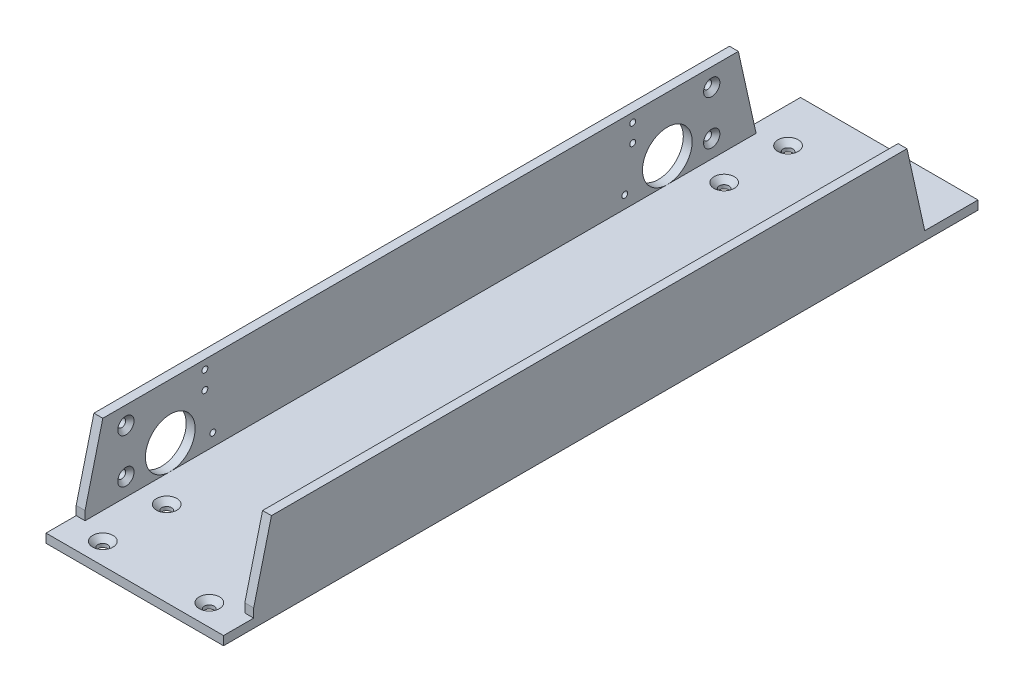
from build123d import *

# Parameters (mm, degrees)
EXTRUDE_1_DEPTH               = 400
HOLE_WIZARD_M51_AT_2_COUNT    = 2
HOLE_WIZARD_M51_AT_2_PITCH    = 60
HOLE_WIZARD_M51_AT_3_COUNT    = 2
HOLE_WIZARD_M51_AT_3_PITCH    = 69.971422738
HOLE_WIZARD_M51_AT_4_COUNT    = 2
HOLE_WIZARD_M51_AT_4_PITCH    = 36
HOLE_WIZARD_M51_AT_5_COUNT    = 2
HOLE_WIZARD_M51_AT_5_PITCH    = 350
HOLE_WIZARD_M51_AT_6_COUNT    = 2
HOLE_WIZARD_M51_AT_6_PITCH    = 355.105618091
HOLE_WIZARD_M51_AT_7_COUNT    = 2
HOLE_WIZARD_M51_AT_7_PITCH    = 390.635379862
HOLE_WIZARD_M51_AT_8_COUNT    = 2
HOLE_WIZARD_M51_AT_8_PITCH    = 386
HOLE_WIZARD_M41_D             = 3.3
HOLE_WIZARD_M41_DEPTH         = 11.5
HOLE_WIZARD_M41_CSINK_D       = 4.05
HOLE_WIZARD_M41_CSINK_ANGLE   = 120
HOLE_WIZARD_M41_TIP           = 0.991420021
HOLE_WIZARD_M42_D             = 3.3
HOLE_WIZARD_M42_DEPTH         = 11.5
HOLE_WIZARD_M42_CSINK_D       = 4.05
HOLE_WIZARD_M42_CSINK_ANGLE   = 120
HOLE_WIZARD_M42_TIP           = 0.991420021
SKETCH_8_R                    = 14
CUT_EXTRUDE_2_DEPTH           = 10
EXTRUDE_2_DEPTH               = 10
CUT_EXTRUDE_3_DEPTH           = 425.970587218
SKETCH_12_W                   = 100
SKETCH_12_H                   = 5
EXTRUDE_3_DEPTH               = 20
HOLE_WIZARD_M41_2_D           = 4.5
HOLE_WIZARD_M41_2_DEPTH       = 5
HOLE_WIZARD_M41_2_CSINK_D     = 9.18
HOLE_WIZARD_M41_2_CSINK_ANGLE = 90


with BuildPart() as part:
    # Эскиз1 → Бобышка-Вытянуть1 (new body)
    with BuildSketch(Plane.XY):
        Polygon((0, 0), (0, 50), (5, 50), (5, 5), (95, 5), (95, 50), (100, 50), (100, 0), align=None)
    extrude(amount=EXTRUDE_1_DEPTH)

    # Эскиз9 → Зенковка для винта с потайной головкой и внутренним шестигранником M51 (revolve, cut)
    with BuildSketch(Plane(origin=(80, 5, 393), x_dir=(0, 0, 1), z_dir=(1, 0, 0))):
        Polygon((0, 0), (0, 5), (2.75, 5), (2.75, 2.985), (5.735, 0), align=None)
    hole_wizard_m51 = revolve(axis=Axis((80, 11.35, 393), (0, -1, 0)), mode=Mode.SUBTRACT)

    # Зенковка для винта с потайной головкой и внутренним шестигранником M51 at 2: Зенковка для винта с потайной головкой и внутренним шестигранником M51 ×2
    with Locations(*[(-i * HOLE_WIZARD_M51_AT_2_PITCH, 0, 0) for i in range(1, HOLE_WIZARD_M51_AT_2_COUNT)]):
        add(hole_wizard_m51, mode=Mode.SUBTRACT)

    # Зенковка для винта с потайной головкой и внутренним шестигранником M51 at 3: Зенковка для винта с потайной головкой и внутренним шестигранником M51 ×2
    with Locations(*[Vector(-0.8574929257125445, 0, -0.514495755427526) * (i * HOLE_WIZARD_M51_AT_3_PITCH) for i in range(1, HOLE_WIZARD_M51_AT_3_COUNT)]):
        add(hole_wizard_m51, mode=Mode.SUBTRACT)

    # Зенковка для винта с потайной головкой и внутренним шестигранником M51 at 4: Зенковка для винта с потайной головкой и внутренним шестигранником M51 ×2
    with Locations(*[(0, 0, -i * HOLE_WIZARD_M51_AT_4_PITCH) for i in range(1, HOLE_WIZARD_M51_AT_4_COUNT)]):
        add(hole_wizard_m51, mode=Mode.SUBTRACT)

    # Зенковка для винта с потайной головкой и внутренним шестигранником M51 at 5: Зенковка для винта с потайной головкой и внутренним шестигранником M51 ×2
    with Locations(*[(0, 0, -i * HOLE_WIZARD_M51_AT_5_PITCH) for i in range(1, HOLE_WIZARD_M51_AT_5_COUNT)]):
        add(hole_wizard_m51, mode=Mode.SUBTRACT)

    # Зенковка для винта с потайной головкой и внутренним шестигранником M51 at 6: Зенковка для винта с потайной головкой и внутренним шестигранником M51 ×2
    with Locations(*[Vector(-0.16896381511084574, 0, -0.9856222548132667) * (i * HOLE_WIZARD_M51_AT_6_PITCH) for i in range(1, HOLE_WIZARD_M51_AT_6_COUNT)]):
        add(hole_wizard_m51, mode=Mode.SUBTRACT)

    # Зенковка для винта с потайной головкой и внутренним шестигранником M51 at 7: Зенковка для винта с потайной головкой и внутренним шестигранником M51 ×2
    with Locations(*[Vector(-0.1535959185806014, 0, -0.9881337428685356) * (i * HOLE_WIZARD_M51_AT_7_PITCH) for i in range(1, HOLE_WIZARD_M51_AT_7_COUNT)]):
        add(hole_wizard_m51, mode=Mode.SUBTRACT)

    # Зенковка для винта с потайной головкой и внутренним шестигранником M51 at 8: Зенковка для винта с потайной головкой и внутренним шестигранником M51 ×2
    with Locations(*[(0, 0, -i * HOLE_WIZARD_M51_AT_8_PITCH) for i in range(1, HOLE_WIZARD_M51_AT_8_COUNT)]):
        add(hole_wizard_m51, mode=Mode.SUBTRACT)

    # Hole Wizard M41
    with Locations(Plane.ZY):
        with Locations((84, 12), (316, 12)):
            CounterSinkHole(HOLE_WIZARD_M41_D / 2, HOLE_WIZARD_M41_CSINK_D / 2, depth=HOLE_WIZARD_M41_DEPTH, counter_sink_angle=HOLE_WIZARD_M41_CSINK_ANGLE)
            with Locations((0, 0, -(HOLE_WIZARD_M41_DEPTH + HOLE_WIZARD_M41_TIP / 2))):  # 118° drill point
                Cone(0, HOLE_WIZARD_M41_D / 2, HOLE_WIZARD_M41_TIP, mode=Mode.SUBTRACT)

    # Отверстие обработанное метчиком M42
    with Locations(Plane.ZY):
        with Locations((320.5, 35), (320.5, 45), (79.5, 45), (79.5, 35)):
            CounterSinkHole(HOLE_WIZARD_M42_D / 2, HOLE_WIZARD_M42_CSINK_D / 2, depth=HOLE_WIZARD_M42_DEPTH, counter_sink_angle=HOLE_WIZARD_M42_CSINK_ANGLE)
            with Locations((0, 0, -(HOLE_WIZARD_M42_DEPTH + HOLE_WIZARD_M42_TIP / 2))):  # 118° drill point
                Cone(0, HOLE_WIZARD_M42_D / 2, HOLE_WIZARD_M42_TIP, mode=Mode.SUBTRACT)

    # Эскиз8 → Вырез-Вытянуть2 (cut)
    with BuildSketch(Plane(origin=(5, 0, 0), x_dir=(0, 0, -1), z_dir=(1, 0, 0))):
        with Locations((-340, 19)):
            Circle(SKETCH_8_R)
        with Locations((-60, 19)):
            Circle(SKETCH_8_R)
    extrude(amount=-CUT_EXTRUDE_2_DEPTH, mode=Mode.SUBTRACT)

    # Эскиз3 → Бобышка-Вытянуть2 (add)
    with BuildSketch(Plane.XY.offset(400)):
        Polygon((95, 5), (5, 5), (5, 50), (0, 50), (0, 0), (100, 0), (100, 50), (95, 50), align=None)
    extrude(amount=EXTRUDE_2_DEPTH)

    # Эскиз11 → Вырез-Вытянуть3 (cut, through all)
    with BuildSketch(Plane(origin=(100, 0, 0), x_dir=(0, 0, -1), z_dir=(1, 0, 0))):
        Polygon((-410, 10), (-410, 5), (-410, 0), (-405, 0), (-405, 5), (-388, 5), (-388, 10), (-378, 50), (-410, 50), align=None)
        Polygon((0, 5), (-10, 5), (-20, 50), (0, 50), align=None)
    extrude(amount=-CUT_EXTRUDE_3_DEPTH, mode=Mode.SUBTRACT)

    # Эскиз12 → Бобышка-Вытянуть3 (add)
    with BuildSketch(Plane(origin=(0, 0, 0), x_dir=(-1, 0, 0), z_dir=(0, 0, -1))):
        with Locations((-50, 2.5)):
            Rectangle(SKETCH_12_W, SKETCH_12_H)
    extrude(amount=EXTRUDE_3_DEPTH)

    # Hole Wizard M41 2
    with Locations(Plane(origin=(5, 0, 0), x_dir=(0, 0, -1), z_dir=(1, 0, 0))):
        with Locations((-365, 40), (-365, 15), (-35, 15), (-35, 40)):
            CounterSinkHole(HOLE_WIZARD_M41_2_D / 2, HOLE_WIZARD_M41_2_CSINK_D / 2, depth=HOLE_WIZARD_M41_2_DEPTH, counter_sink_angle=HOLE_WIZARD_M41_2_CSINK_ANGLE)


solid = part.part
